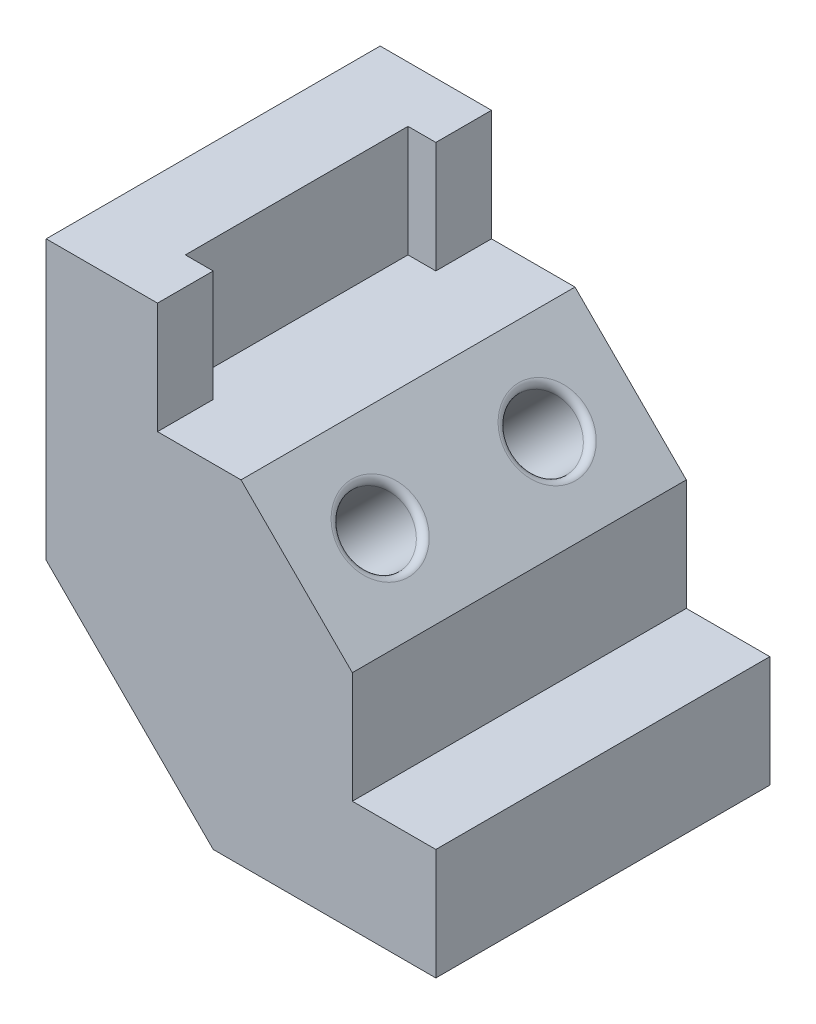
from build123d import *

# Parameters (mm, degrees)
BOSS_EXTRUDE2_DEPTH = 76.2
SKETCH3_W           = 6.35
SKETCH3_H           = 50.8
CUT_EXTRUDE1_DEPTH  = 25.4
SKETCH4_R           = 7.62
CUT_EXTRUDE2_DEPTH  = 53.34
FILLET2_R           = 1.524


with BuildPart() as part:
    # Sketch2 → Boss-Extrude2 (new body)
    with BuildSketch(Plane.XY):
        Polygon((0, 48.351318045), (0, -15.148681955), (38.1, -53.248681955), (88.9, -53.248681955), (88.9, -27.848681955), (69.85, -27.848681955), (69.85, -2.448681955), (44.45, 22.951318045), (25.4, 22.951318045), (25.4, 48.351318045), align=None)
    extrude(amount=-BOSS_EXTRUDE2_DEPTH)

    # Sketch3 → Cut-Extrude1 (cut)
    with BuildSketch(Plane(origin=(0, 48.351318045, 0), x_dir=(1, 0, 0), z_dir=(0, 1, 0))):
        with Locations((22.225, 38.1)):
            Rectangle(SKETCH3_W, SKETCH3_H)
    extrude(amount=-CUT_EXTRUDE1_DEPTH, mode=Mode.SUBTRACT)

    # Sketch4 → Cut-Extrude2 (cut)
    with BuildSketch(Plane(origin=(33.700659023, 33.700659023, 0), x_dir=(0, 0, -1), z_dir=(0.7071067811865488, 0.7071067811865462, 0))):
        with Locations(Location((19.05, -33.165088281, 0), (0, 0, 90))):
            Circle(SKETCH4_R)
        with Locations(Location((57.15, -33.165088281, 0), (0, 0, 90))):
            Circle(SKETCH4_R)
    extrude(amount=-CUT_EXTRUDE2_DEPTH, mode=Mode.SUBTRACT)

    # Fillet2
    fillet2_edges = [part.edges().sort_by_distance(p)[0] for p in [
        (62.540071517, 4.861246528, -19.05),
        (62.540071517, 4.861246528, -57.15),
    ]]
    fillet(fillet2_edges, radius=FILLET2_R)


solid = part.part
